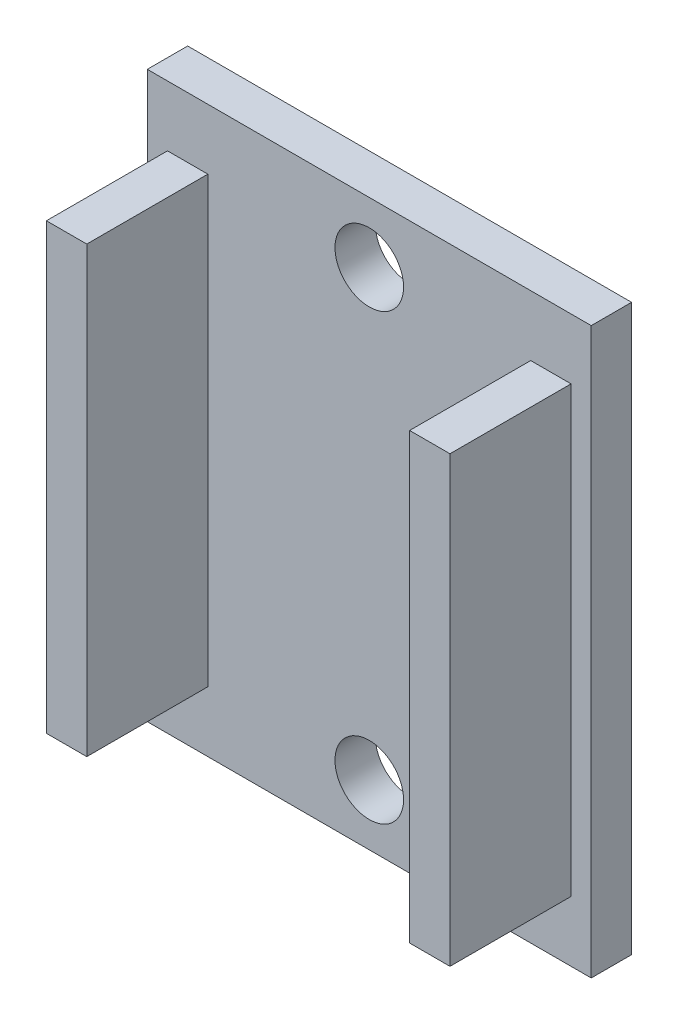
from build123d import *

# Parameters (mm, degrees)
MAIN_PROFILE_SKETCH_W     = 22
MAIN_PROFILE_SKETCH_H     = 28
MAIN_PROFILE_SKETCH_R     = 1.7
MAIN_EXTRUSION_DEPTH      = 2
DETAIL_PROFILE_2_SKETCH_W = 2
DETAIL_PROFILE_2_SKETCH_H = 22
DETAIL_EXTRUSION_2_DEPTH  = 6


with BuildPart() as part:
    # Main Profile Sketch → Main Extrusion (new body)
    with BuildSketch(Plane.XY.offset(88)):
        with Locations((-203, 29)):
            Rectangle(MAIN_PROFILE_SKETCH_W, MAIN_PROFILE_SKETCH_H)
        with Locations((-203, 18)):
            Circle(MAIN_PROFILE_SKETCH_R, mode=Mode.SUBTRACT)
        with Locations((-203, 40)):
            Circle(MAIN_PROFILE_SKETCH_R, mode=Mode.SUBTRACT)
    extrude(amount=MAIN_EXTRUSION_DEPTH)

    # Detail Profile 2 Sketch → Detail Extrusion 2 (add)
    with BuildSketch(Plane.XY.offset(90)):
        with Locations((-194, 29)):
            Rectangle(DETAIL_PROFILE_2_SKETCH_W, DETAIL_PROFILE_2_SKETCH_H)
        with Locations((-212, 29)):
            Rectangle(DETAIL_PROFILE_2_SKETCH_W, DETAIL_PROFILE_2_SKETCH_H)
    extrude(amount=DETAIL_EXTRUSION_2_DEPTH)


solid = part.part
